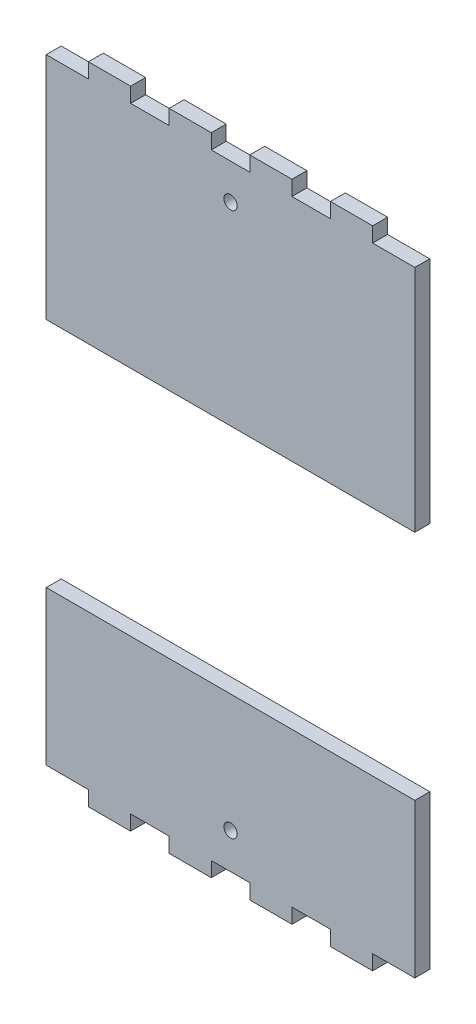
from build123d import *

# Parameters (mm, degrees)
SKETCH1_W           = 110.9218
SKETCH1_H           = 185.1914
BOSS_EXTRUDE1_DEPTH = 4.4958
SKETCH2_W           = 12.7
SKETCH2_H           = 4.4958
BOSS_EXTRUDE2_DEPTH = 4.4958
SKETCH3_W           = 114.3
SKETCH3_H           = 69.85
CUT_EXTRUDE1_DEPTH  = 220.784193646
SKETCH4_R           = 2
CUT_EXTRUDE2_DEPTH  = 220.784193646


with BuildPart() as part:
    # Sketch1 → Boss-Extrude1 (new body)
    with BuildSketch(Plane.XY):
        with Locations((55.4609, 92.5957)):
            Rectangle(SKETCH1_W, SKETCH1_H)
    extrude(amount=BOSS_EXTRUDE1_DEPTH)

    # Sketch2 → Boss-Extrude2 (add)
    with BuildSketch(Plane.XY.offset(4.4958)):
        with Locations((19.05, 187.4393)):
            Rectangle(SKETCH2_W, SKETCH2_H)
        with Locations((43.323933333, 187.4393)):
            Rectangle(SKETCH2_W, SKETCH2_H)
        with Locations((67.597866667, 187.4393)):
            Rectangle(SKETCH2_W, SKETCH2_H)
        with Locations((91.8718, 187.4393)):
            Rectangle(SKETCH2_W, SKETCH2_H)
        with Locations((91.8718, -2.2479)):
            Rectangle(SKETCH2_W, SKETCH2_H)
        with Locations((67.597866667, -2.2479)):
            Rectangle(SKETCH2_W, SKETCH2_H)
        with Locations((43.323933333, -2.2479)):
            Rectangle(SKETCH2_W, SKETCH2_H)
        with Locations((19.05, -2.2479)):
            Rectangle(SKETCH2_W, SKETCH2_H)
    extrude(amount=-BOSS_EXTRUDE2_DEPTH)

    # Sketch3 → Cut-Extrude1 (cut, through all)
    with BuildSketch(Plane.XY.offset(4.4958)):
        with Locations((53.7718, 81.2292)):
            Rectangle(SKETCH3_W, SKETCH3_H)
    extrude(amount=-CUT_EXTRUDE1_DEPTH, mode=Mode.SUBTRACT)


with BuildPart() as cut_extrude1_piece_1:
    # of the separate pieces the step leaves, piece 1, a body of its own (cut_extrude1_pieces)
    add(part.part.solids().sort_by_distance((0, 185.1914, 0))[0])


with BuildPart() as cut_extrude1_piece_2:
    # of the separate pieces the step leaves, piece 2, a body of its own (cut_extrude1_pieces)
    add(part.part.solids().sort_by_distance((0, 0, 0))[0])


with BuildPart() as cut_extrude2_tool:
    # Sketch4 → Cut-Extrude2 (new, through all)
    with BuildSketch(Plane(origin=(0, 0, 0), x_dir=(-1, 0, 0), z_dir=(0, 0, -1))):
        with Locations((-55.4609, 174.4472)):
            Circle(SKETCH4_R)
        with Locations((-55.4609, 10.7442)):
            Circle(SKETCH4_R)
    extrude(amount=-CUT_EXTRUDE2_DEPTH)


with BuildPart() as cut_extrude1_piece_1_1:
    add(cut_extrude1_piece_1.part)

    # Cut-Extrude2: cut by cut_extrude2_tool
    add(cut_extrude2_tool.part, mode=Mode.SUBTRACT)


with BuildPart() as cut_extrude1_piece_2_1:
    add(cut_extrude1_piece_2.part)

    # Cut-Extrude2: cut by cut_extrude2_tool
    add(cut_extrude2_tool.part, mode=Mode.SUBTRACT)


solid = Compound([cut_extrude1_piece_1_1.part, cut_extrude1_piece_2_1.part])
